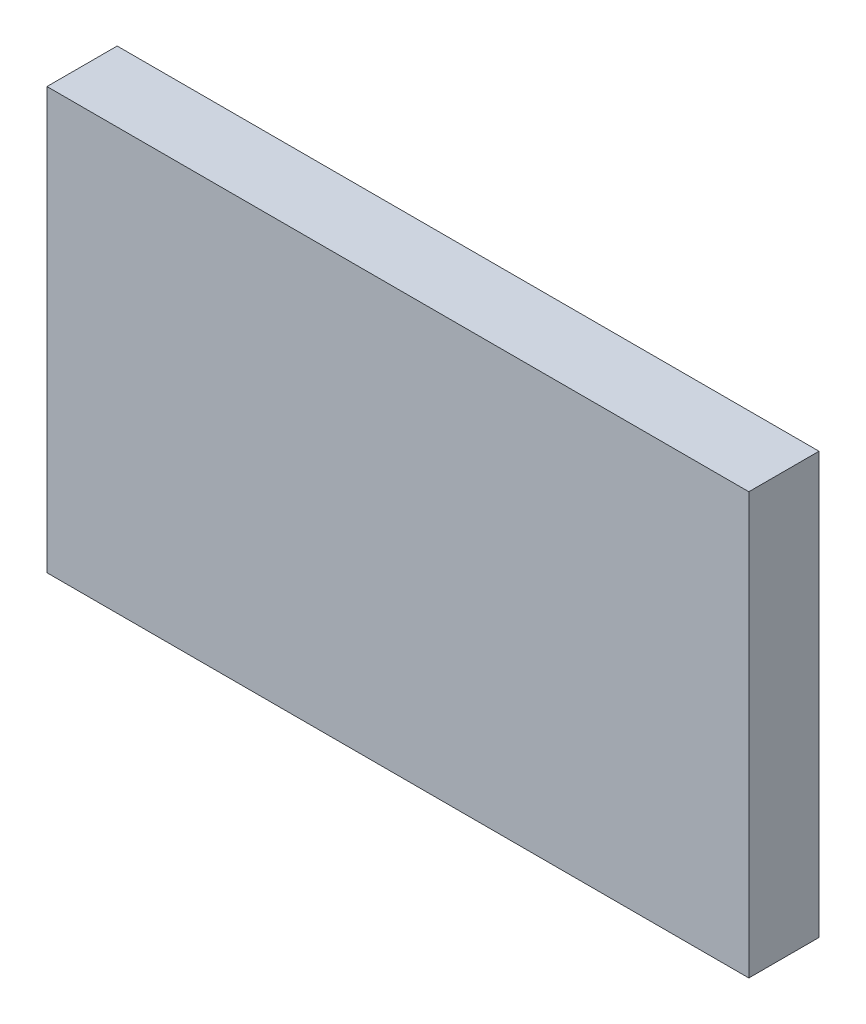
from build123d import *

# Parameters (mm, degrees)
SKETCH_1_W      = 500
SKETCH_1_H      = 300
EXTRUDE_1_DEPTH = 50


with BuildPart() as part:
    # 草图1 → 凸台-拉伸1 (new body)
    with BuildSketch(Plane.XY):
        Rectangle(SKETCH_1_W, SKETCH_1_H)
    extrude(amount=EXTRUDE_1_DEPTH)


solid = part.part
